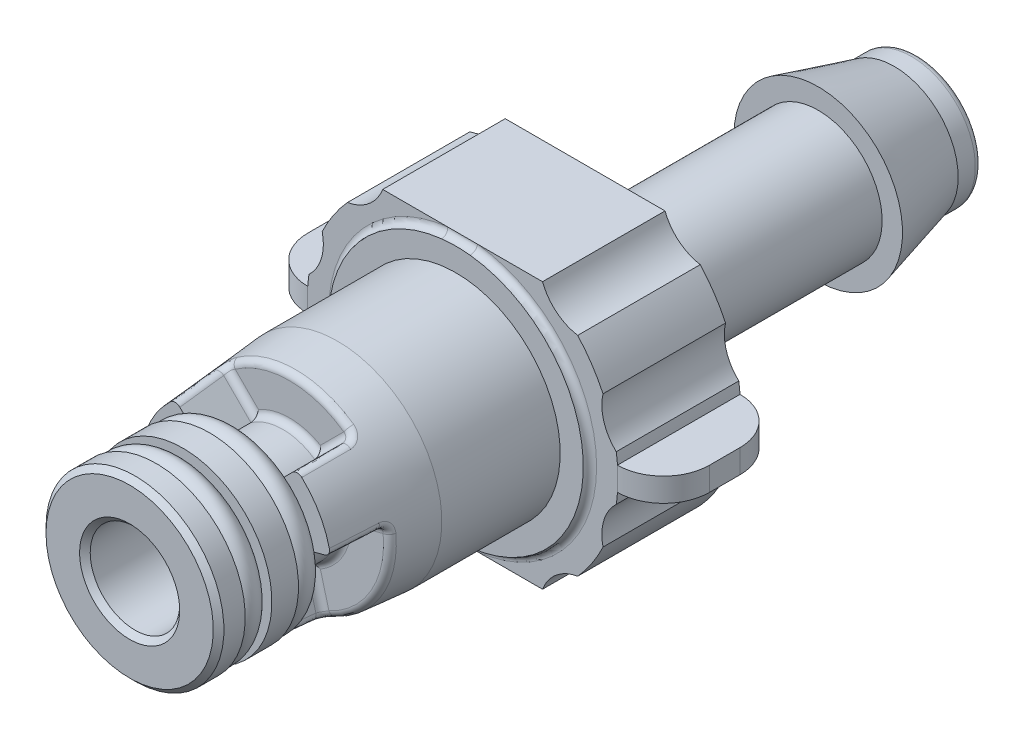
from build123d import *

# Parameters (mm, degrees)
BODY_DEPTH          = 21.717
SKETCH3_R           = 3.048
BOSS_EXTRUDE2_DEPTH = 15.875
SKETCH6_R           = 2.7432
BARB_END_DEPTH      = 4.7625
BARB_END_DRAFT      = 15
SKETCH7_R           = 2.1336
CUT_EXTRUDE1_DEPTH  = 39.837090056
SKETCH11_W          = 4.348340641
SKETCH11_H          = 1.123520476
BOSS_EXTRUDE5_DEPTH = 5.842
CUT_EXTRUDE3_DEPTH  = 33.476793172
FILLET1_R           = 0.635
FILLET3_R           = 0.3175
SKETCH13_R          = 0.5715
CUT_EXTRUDE4_DEPTH  = 2.54
CIRPATTERN1_COUNT   = 3
FILLET4_R           = 0.3175
CHAMFER1_SIZE       = 0.254


with BuildPart() as part:
    # Sketch2 → Body (new body)
    with BuildSketch(Plane.XY):
        with BuildLine():
            Line((-3.81, 6.35), (3.81, 6.35))
            ThreePointArc((3.81, 6.35), (4.464574443, 5.436856771), (5.487601552, 4.972406782))
            ThreePointArc((5.487601552, 4.972406782), (6.158091293, 4.112968713), (6.695153406, 3.164414774))
            ThreePointArc((6.695153406, 3.164414774), (6.732315886, 2.041509076), (7.325083334, 1.08708516))
            ThreePointArc((7.325083334, 1.08708516), (7.405308906, 0), (7.325083334, -1.08708516))
            ThreePointArc((7.325083334, -1.08708516), (6.732315886, -2.041509076), (6.695153406, -3.164414774))
            ThreePointArc((6.695153406, -3.164414774), (6.158091293, -4.112968713), (5.487601552, -4.972406782))
            ThreePointArc((5.487601552, -4.972406782), (4.464574443, -5.436856771), (3.81, -6.35))
            Line((3.81, -6.35), (-3.81, -6.35))
            ThreePointArc((-3.81, -6.35), (-4.464574443, -5.436856771), (-5.487601552, -4.972406782))
            ThreePointArc((-5.487601552, -4.972406782), (-6.158091293, -4.112968713), (-6.695153406, -3.164414774))
            ThreePointArc((-6.695153406, -3.164414774), (-6.732315886, -2.041509076), (-7.325083334, -1.08708516))
            ThreePointArc((-7.325083334, -1.08708516), (-7.405308906, 0), (-7.325083334, 1.08708516))
            ThreePointArc((-7.325083334, 1.08708516), (-6.732315886, 2.041509076), (-6.695153406, 3.164414774))
            ThreePointArc((-6.695153406, 3.164414774), (-6.158091293, 4.112968713), (-5.487601552, 4.972406782))
            ThreePointArc((-5.487601552, 4.972406782), (-4.464574443, 5.436856771), (-3.81, 6.35))
        make_face()
    extrude(amount=BODY_DEPTH)

    # Sketch3 → Boss-Extrude2 (add)
    with BuildSketch(Plane(origin=(0, 0, 0), x_dir=(-1, 0, 0), z_dir=(0, 0, -1))):
        Circle(SKETCH3_R)
    extrude(amount=BOSS_EXTRUDE2_DEPTH)

    # Sketch5 → Cut-Revolve1 (revolve, cut)
    with BuildSketch(Plane(origin=(0, 0, 0), x_dir=(0, 0, -1), z_dir=(1, 0, 0))):
        Polygon((-12.121527897, 6.627646697), (-12.121527897, 6.072353303), (-5.842, 6.072353303), (-5.842, 6.627646697), (-5.842, 12.907174593), (-12.121527897, 12.907174593), align=None)
    revolve(axis=Axis((0, 0, 0), (0, 0, 1)), mode=Mode.SUBTRACT)


with BuildPart() as barb_end_tool:
    # Sketch6 → Barb End (with draft: the straight prism first)
    with BuildSketch(Plane(origin=(0, 0, -15.875), x_dir=(-1, 0, 0), z_dir=(0, 0, -1))):
        Circle(SKETCH6_R)
    extrude(amount=-BARB_END_DEPTH)
    # Barb End: the draft: its side faces are tilted about the plane it starts from
    barb_end_sides = [barb_end_tool.faces().sort_by_distance(p)[0] for p in [
        (2.7432, 0, -13.49375),
    ]]
    draft(barb_end_sides, Plane(origin=(0, 0, -15.875), x_dir=(-1, 0, 0), z_dir=(0, 0, -1)), BARB_END_DRAFT)


with BuildPart() as part_1:
    add(part.part)

    # Barb End: add barb_end_tool
    add(barb_end_tool.part)

    # Sketch7 → Cut-Extrude1 (cut, through all)
    with BuildSketch(Plane(origin=(0, 0, -15.875), x_dir=(-1, 0, 0), z_dir=(0, 0, -1))):
        Circle(SKETCH7_R)
    extrude(amount=-CUT_EXTRUDE1_DEPTH, mode=Mode.SUBTRACT)

    # Sketch11 → Boss-Extrude5 (add)
    with BuildSketch(Plane(origin=(0, 0, 0), x_dir=(-1, 0, 0), z_dir=(0, 0, -1))):
        with Locations((7.405308907, 0)):
            Rectangle(SKETCH11_W, SKETCH11_H)
    boss_extrude5 = extrude(amount=-BOSS_EXTRUDE5_DEPTH)

    # Sketch12 → Cut-Extrude3 (cut)
    with BuildSketch(Plane(origin=(0, 0.561760238, 0), x_dir=(1, 0, 0), z_dir=(0, 1, 0))):
        with BuildLine():
            Line((-9.579479227, -2.195508382), (-9.579479227, -3.646491618))
            ThreePointArc((-9.579479227, -3.646491618), (-8.93642971, -5.198950483), (-7.383970845, -5.842))
            Line((-7.383970845, -5.842), (-7.383970845, -7.971922918))
            Line((-7.383970845, -7.971922918), (-11.709402145, -7.971922918))
            Line((-11.709402145, -7.971922918), (-11.709402145, 2.129922918))
            Line((-11.709402145, 2.129922918), (-7.383970845, 2.129922918))
            Line((-7.383970845, 2.129922918), (-7.383970845, 0))
            ThreePointArc((-7.383970845, 0), (-8.93642971, -0.643049517), (-9.579479227, -2.195508382))
        make_face()
    cut_extrude3 = extrude(amount=-CUT_EXTRUDE3_DEPTH, mode=Mode.SUBTRACT)

    # Mirror1: Boss-Extrude5, Cut-Extrude3 across plane
    add(boss_extrude5.mirror(Plane(origin=(0, 0, 0), x_dir=(0, 0, 1), z_dir=(1, 0, 0))))
    add(cut_extrude3.mirror(Plane(origin=(0, 0, 0), x_dir=(0, 0, 1), z_dir=(1, 0, 0))), mode=Mode.SUBTRACT)

    # Fillet1
    fillet1_edges = [part_1.edges().sort_by_distance(p)[0] for p in [
        (3.048, 0, 0),
    ]]
    fillet(fillet1_edges, radius=FILLET1_R)

    # Fillet3
    fillet3_edges = [part_1.edges().sort_by_distance(p)[0] for p in [
        (3.048, 0, -15.875),
        (0, -6.072353303, 12.121527897),
        (0, -6.072353303, 5.842),
    ]]
    fillet(fillet3_edges, radius=FILLET3_R)

    # Sketch13 → Cut-Revolve2 (revolve, cut)
    with BuildSketch(Plane(origin=(0, 0, 0), x_dir=(0, 0, -1), z_dir=(1, 0, 0)), mode=Mode.PRIVATE) as cut_revolve2_sk:
        Polygon((-6.1595, 6.034480237), (-6.1595, 4.972406782), (-11.804027897, 4.972406782), (-16.637, 4.563866508), (-16.637, 2.9718), (-17.907, 2.9718), (-17.907, 4.2418), (-19.177, 4.2418), (-19.177, 2.9718), (-20.447, 2.9718), (-20.447, 4.2418), (-21.717, 4.2418), (-21.717, 6.35), (-21.717, 8.4582), (-6.1595, 8.4582), align=None)
        with Locations((-17.272, 3.6068)):
            Circle(SKETCH13_R, mode=Mode.SUBTRACT)
        with Locations((-19.812, 3.6068)):
            Circle(SKETCH13_R, mode=Mode.SUBTRACT)
    revolve(cut_revolve2_sk.sketch.rotate(Axis((0, 0, 0), (0, 0, 1)), 90), axis=Axis((0, 0, 0), (0, 0, 1)), mode=Mode.SUBTRACT)


with BuildPart() as cut_revolve2_piece_1:
    # of the separate pieces the step leaves, piece 1, a body of its own (cut_revolve2_pieces)
    add(part_1.part.solids().sort_by_distance((-0.712548411, -6.35, 5.842))[0])

    # Sketch14 → Cut-Extrude4 (cut)
    with BuildSketch(Plane.XY.offset(16.637)):
        with BuildLine():
            Line((-1.521288836, 2.151427304), (-2.896654622, 3.52679309))
            Line((-2.896654622, 3.52679309), (-4.272020408, 4.902158876))
            ThreePointArc((-4.272020408, 4.902158876), (0, 6.502408786), (4.272020408, 4.902158876))
            Line((4.272020408, 4.902158876), (2.896654622, 3.52679309))
            Line((2.896654622, 3.52679309), (1.521288836, 2.151427304))
            ThreePointArc((1.521288836, 2.151427304), (0, 2.634949557), (-1.521288836, 2.151427304))
        make_face()
    cut_extrude4 = extrude(amount=-CUT_EXTRUDE4_DEPTH, mode=Mode.SUBTRACT)

    # CirPattern1: Cut-Extrude4 ×3 about axis
    cirpattern1_axis = Axis((0, 0, -15.875), (0, 0, 1))
    for i in range(1, CIRPATTERN1_COUNT):
        add(cut_extrude4.rotate(cirpattern1_axis, i * 360 / CIRPATTERN1_COUNT), mode=Mode.SUBTRACT)

    # Fillet4
    fillet4_edges = [cut_revolve2_piece_1.edges().sort_by_distance(p)[0] for p in [
        (0, 4.778577513, 14.097),
        (-2.972922331, 3.603060799, 15.36700096),
        (-2.285231445, 2.915369913, 14.097),
        (2.285231445, 2.915369913, 14.097),
        (2.972922331, 3.603060799, 15.36700096),
        (0, 2.634949557, 14.097),
        (-1.633881018, -4.376156662, 15.36700096),
        (-1.382168684, -3.436753441, 14.097),
        (-3.922741424, -2.728901385, 14.097),
        (-3.667400129, 0.521383528, 14.097),
        (-4.606803349, 0.773095863, 15.36700096),
        (-2.281933254, -1.317474778, 14.097),
        (4.606803349, 0.773095863, 15.36700096),
        (3.667400129, 0.521383528, 14.097),
        (4.13836952, -2.389288756, 14.097),
        (1.382168684, -3.436753441, 14.097),
        (1.633881018, -4.376156662, 15.36700096),
        (2.281933254, -1.317474778, 14.097),
    ]]
    fillet(fillet4_edges, radius=FILLET4_R)

    # Chamfer1
    chamfer1_edges = [cut_revolve2_piece_1.edges().sort_by_distance(p)[0] for p in [
        (2.1336, 0, 21.717),
        (4.2418, 0, 21.717),
    ]]
    chamfer(chamfer1_edges, length=CHAMFER1_SIZE)


with BuildPart() as cut_revolve2_piece_2:
    # of the separate pieces the step leaves, piece 2, a body of its own (cut_revolve2_pieces)
    add(part_1.part.solids().sort_by_distance((-3.6068, 0, 19.2405))[0])


with BuildPart() as cut_revolve2_piece_3:
    # of the separate pieces the step leaves, piece 3, a body of its own (cut_revolve2_pieces)
    add(part_1.part.solids().sort_by_distance((-3.6068, 0, 16.7005))[0])


solid = Compound([cut_revolve2_piece_1.part, cut_revolve2_piece_2.part, cut_revolve2_piece_3.part])
